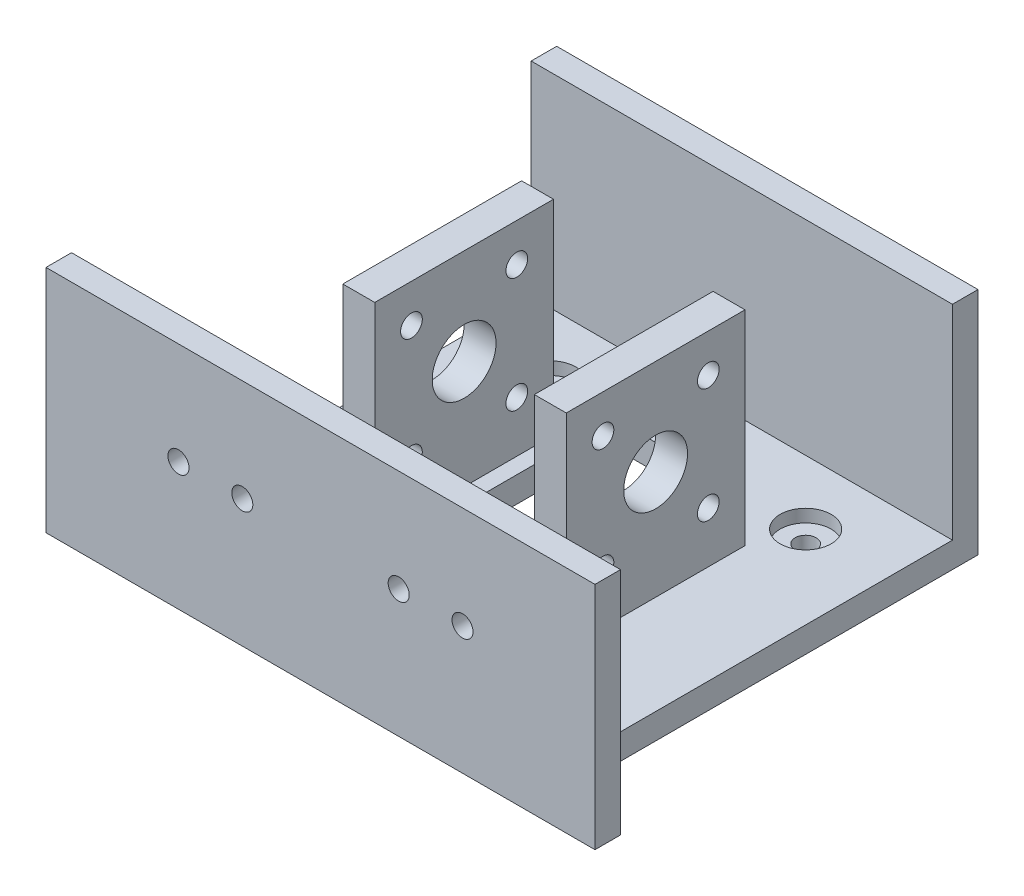
from build123d import *

# Parameters (mm, degrees)
SKETCH1_W                 = 75
SKETCH1_H                 = 40
SKETCH1_R                 = 5
SKETCH1_R_2               = 1.7
SKETCH1_W_2               = 10
SKETCH1_H_2               = 20
BOSS_EXTRUDE1_DEPTH       = 3
CUT_EXTRUDE1_DEPTH        = 43.605750786
CUT_EXTRUDE1_DEPTH_BACK   = 43.605750786
SKETCH2_W                 = 67
SKETCH2_H                 = 28
BOSS_EXTRUDE3_DEPTH       = 110
BOSS_EXTRUDE3_DEPTH_BACK  = 3
SKETCH6_W                 = 67
SKETCH6_H                 = 11
CUT_EXTRUDE4_DEPTH        = 122.372360939
SKETCH7_W                 = 70
SKETCH7_H                 = 37
BOSS_EXTRUDE4_DEPTH       = 45
SKETCH8_W                 = 45
SKETCH8_H                 = 62
CUT_EXTRUDE6_DEPTH        = 29
SKETCH11_W                = 45
SKETCH11_H                = 4
CUT_EXTRUDE9_DEPTH        = 157.445677473
SKETCH9_W                 = 38
SKETCH9_H                 = 28.5
CUT_EXTRUDE10_DEPTH       = 204.024629048
SKETCH13_W                = 5
SKETCH13_H                = 38
BOSS_EXTRUDE5_DEPTH       = 32
SKETCH14_R                = 5
SKETCH14_R_2              = 1.7
CUT_EXTRUDE11_DEPTH       = 32
SKETCH15_W                = 165
SKETCH15_H                = 70
SKETCH15_W_2              = 157
SKETCH15_H_2              = 62
BOSS_EXTRUDE6_DEPTH       = 3
SKETCH16_W                = 20
SKETCH16_H                = 4.820648258
CUT_EXTRUDE12_DEPTH       = 159.626132778
SKETCH18_R                = 1.65
CUT_EXTRUDE14_DEPTH       = 159.626132778
MIRROR6_COPY_1_SKETCH_W   = 5
MIRROR6_COPY_1_SKETCH_H   = 38
MIRROR6_COPY_1_DEPTH      = 32
MIRROR6_COPY_2_SKETCH_R   = 5
MIRROR6_COPY_2_SKETCH_R_2 = 1.7
MIRROR6_COPY_2_DEPTH      = 32
SKETCH19_W                = 38
SKETCH19_H                = 3.5
CUT_EXTRUDE15_DEPTH       = 10
SKETCH20_R                = 1.2
CUT_EXTRUDE16_DEPTH       = 10
SKETCH21_W                = 10
SKETCH21_H                = 80
CUT_EXTRUDE17_DEPTH       = 184.330984833
SKETCH22_W                = 55
SKETCH22_H                = 80
CUT_EXTRUDE18_DEPTH       = 184.330984833
SKETCH23_W                = 67
SKETCH23_H                = 62
BOSS_EXTRUDE7_DEPTH       = 4
SKETCH24_R                = 10
SKETCH24_R_2              = 1.65
CUT_EXTRUDE19_DEPTH       = 111.123793978
CUT_EXTRUDE21_START       = -16
SKETCH25_R                = 1.65
CUT_EXTRUDE21_DEPTH       = 16
SKETCH26_W                = 14.5
SKETCH26_H                = 36
CUT_EXTRUDE22_DEPTH       = 178.837706913
SKETCH27_W                = 5
SKETCH27_H                = 64
CUT_EXTRUDE23_DEPTH       = 43
CUT_EXTRUDE24_DEPTH       = 100.724620832
SKETCH29_R                = 4
SKETCH29_R_2              = 1.65
CUT_EXTRUDE25_DEPTH       = 2
SKETCH30_W                = 5
SKETCH30_H                = 28
BOSS_EXTRUDE8_DEPTH       = 32
CUT_EXTRUDE26_START       = -32
SKETCH32_R                = 5
SKETCH32_R_2              = 1.7
CUT_EXTRUDE26_DEPTH       = 32
CUT_EXTRUDE27_DEPTH       = 32
SKETCH36_R                = 1.65
CUT_EXTRUDE28_DEPTH       = 10
SKETCH37_W                = 6.586786374
SKETCH37_H                = 6.17536381
BOSS_EXTRUDE9_DEPTH       = 4
SKETCH38_W                = 25
SKETCH38_H                = 36
CUT_EXTRUDE29_DEPTH       = 10


with BuildPart() as part:
    # Sketch1 → Boss-Extrude1 (new body)
    with BuildSketch(Plane(origin=(0, 0, 0), x_dir=(1, 0, 0), z_dir=(0, 1, 0))):
        Rectangle(SKETCH1_W, SKETCH1_H)
        with Locations(Location((-21, 0, 0), (0, 0, 270))):
            Circle(SKETCH1_R, mode=Mode.SUBTRACT)
        with Locations(Location((-30, 8.25, 0), (0, 0, 270))):
            Circle(SKETCH1_R_2, mode=Mode.SUBTRACT)
        with Locations(Location((-12, 8.25, 0), (0, 0, 270))):
            Circle(SKETCH1_R_2, mode=Mode.SUBTRACT)
        with Locations(Location((-12, -8.25, 0), (0, 0, 270))):
            Circle(SKETCH1_R_2, mode=Mode.SUBTRACT)
        with Locations(Location((-30, -8.25, 0), (0, 0, 270))):
            Circle(SKETCH1_R_2, mode=Mode.SUBTRACT)
        with Locations(Location((12, 8.25, 0), (0, 0, 90))):
            Circle(SKETCH1_R_2, mode=Mode.SUBTRACT)
        with Locations(Location((12, -8.25, 0), (0, 0, 90))):
            Circle(SKETCH1_R_2, mode=Mode.SUBTRACT)
        with Locations(Location((21, 0, 0), (0, 0, 90))):
            Circle(SKETCH1_R, mode=Mode.SUBTRACT)
        with Locations(Location((30, -8.25, 0), (0, 0, 90))):
            Circle(SKETCH1_R_2, mode=Mode.SUBTRACT)
        with Locations(Location((30, 8.25, 0), (0, 0, 90))):
            Circle(SKETCH1_R_2, mode=Mode.SUBTRACT)
        Rectangle(SKETCH1_W_2, SKETCH1_H_2, mode=Mode.SUBTRACT)
    extrude(amount=BOSS_EXTRUDE1_DEPTH)

    # Sketch2 → Cut-Extrude1 (cut, two sides: drawn at the far end of the back side and taken through both)
    with BuildSketch(Plane(origin=(0, 3, 0), x_dir=(1, 0, 0), z_dir=(0, 1, 0)).offset(-CUT_EXTRUDE1_DEPTH_BACK)):
        Rectangle(SKETCH2_W, SKETCH2_H)
    extrude(amount=CUT_EXTRUDE1_DEPTH + CUT_EXTRUDE1_DEPTH_BACK, mode=Mode.SUBTRACT)

    # Sketch3 → Boss-Extrude3 (add, two sides: drawn at the far end of the back side and taken through both)
    with BuildSketch(Plane(origin=(0, 3, 0), x_dir=(1, 0, 0), z_dir=(0, 1, 0)).offset(-BOSS_EXTRUDE3_DEPTH_BACK)):
        Polygon((37.5, -35), (37.5, -20), (33.5, -20), (-33.5, -20), (-37.5, -20), (-37.5, -35), align=None)
        Polygon((33.5, 20), (37.5, 20), (37.5, 35), (-37.5, 35), (-37.5, 20), (-33.5, 20), align=None)
        Polygon((37.5, -20), (37.5, 20), (33.5, 20), (33.5, 14), (33.5, -14), (33.5, -20), align=None)
        Polygon((-33.5, 14), (-33.5, 20), (-37.5, 20), (-37.5, -20), (-33.5, -20), (-33.5, -14), align=None)
    extrude(amount=BOSS_EXTRUDE3_DEPTH + BOSS_EXTRUDE3_DEPTH_BACK)

    # Sketch6 → Cut-Extrude4 (cut, through all)
    with BuildSketch(Plane(origin=(0, 3, 0), x_dir=(1, 0, 0), z_dir=(0, 1, 0))):
        with Locations((0, -25.5)):
            Rectangle(SKETCH6_W, SKETCH6_H)
        with Locations((0, 25.5)):
            Rectangle(SKETCH6_W, SKETCH6_H)
    extrude(amount=CUT_EXTRUDE4_DEPTH, mode=Mode.SUBTRACT)

    # Sketch7 → Boss-Extrude4 (add)
    with BuildSketch(Plane.ZY.offset(37.5)):
        with Locations((0, 94.5)):
            Rectangle(SKETCH7_W, SKETCH7_H)
    boss_extrude4 = extrude(amount=BOSS_EXTRUDE4_DEPTH)

    # Mirror2: Boss-Extrude4 across plane
    add(boss_extrude4.mirror(Plane(origin=(0, 0, 0), x_dir=(0, 0, 1), z_dir=(1, 0, 0))))

    # Sketch8 → Cut-Extrude6 (cut)
    with BuildSketch(Plane(origin=(0, 113, 0), x_dir=(1, 0, 0), z_dir=(0, 1, 0))):
        with Locations((-56, 0)):
            Rectangle(SKETCH8_W, SKETCH8_H)
        with Locations((56, 0)):
            Rectangle(SKETCH8_W, SKETCH8_H)
    extrude(amount=-CUT_EXTRUDE6_DEPTH, mode=Mode.SUBTRACT)

    # Sketch11 → Cut-Extrude9 (cut, through all)
    with BuildSketch(Plane.XY.offset(35)):
        with Locations((-60, 78)):
            Rectangle(SKETCH11_W, SKETCH11_H)
        with Locations((60, 78)):
            Rectangle(SKETCH11_W, SKETCH11_H)
    extrude(amount=-CUT_EXTRUDE9_DEPTH, mode=Mode.SUBTRACT)

    # Sketch9 → Cut-Extrude10 (cut, through all)
    with BuildSketch(Plane.ZY.offset(82.5)):
        with Locations((0, 98.25)):
            Rectangle(SKETCH9_W, SKETCH9_H)
    extrude(amount=-CUT_EXTRUDE10_DEPTH, mode=Mode.SUBTRACT)

    # Sketch13 → Boss-Extrude5 (add)
    with BuildSketch(Plane(origin=(0, 84, 0), x_dir=(1, 0, 0), z_dir=(0, 1, 0))):
        with Locations((-39, 0)):
            Rectangle(SKETCH13_W, SKETCH13_H)
    boss_extrude5 = extrude(amount=BOSS_EXTRUDE5_DEPTH)

    # Sketch14 → Cut-Extrude11 (cut)
    with BuildSketch(Plane.ZY.offset(41.5)):
        with Locations((0, 101)):
            Circle(SKETCH14_R)
        with Locations((-8.25, 110)):
            Circle(SKETCH14_R_2)
        with Locations((8.25, 110)):
            Circle(SKETCH14_R_2)
        with Locations((8.25, 92)):
            Circle(SKETCH14_R_2)
        with Locations((-8.25, 92)):
            Circle(SKETCH14_R_2)
    cut_extrude11 = extrude(amount=-CUT_EXTRUDE11_DEPTH, mode=Mode.SUBTRACT)

    # Mirror4: Boss-Extrude5, Cut-Extrude11 across plane
    add(boss_extrude5.mirror(Plane(origin=(0, 0, 0), x_dir=(0, 0, 1), z_dir=(1, 0, 0))))
    add(cut_extrude11.mirror(Plane(origin=(0, 0, 0), x_dir=(0, 0, 1), z_dir=(1, 0, 0))), mode=Mode.SUBTRACT)

    # Sketch15 → Boss-Extrude6 (add)
    with BuildSketch(Plane(origin=(0, 113, 0), x_dir=(1, 0, 0), z_dir=(0, 1, 0))):
        Rectangle(SKETCH15_W, SKETCH15_H)
        Rectangle(SKETCH15_W_2, SKETCH15_H_2, mode=Mode.SUBTRACT)
    extrude(amount=BOSS_EXTRUDE6_DEPTH)

    # Sketch16 → Cut-Extrude12 (cut, through all)
    with BuildSketch(Plane.XY.offset(35)):
        with Locations((0, 11.636111214)):
            Rectangle(SKETCH16_W, SKETCH16_H)
    extrude(amount=-CUT_EXTRUDE12_DEPTH, mode=Mode.SUBTRACT)

    # Sketch18 → Cut-Extrude14 (cut, through all)
    with BuildSketch(Plane.XY.offset(35)):
        with Locations((52.25, 100)):
            Circle(SKETCH18_R)
    cut_extrude14 = extrude(amount=-CUT_EXTRUDE14_DEPTH, mode=Mode.SUBTRACT)

    # Mirror5: Cut-Extrude14 across plane
    add(cut_extrude14.mirror(Plane(origin=(0, 0, 0), x_dir=(0, 0, 1), z_dir=(1, 0, 0))), mode=Mode.SUBTRACT)

    # Mirror6: Boss-Extrude5, Cut-Extrude11 across plane
    add(boss_extrude5.mirror(Plane.ZX.offset(116)))
    add(cut_extrude11.mirror(Plane.ZX.offset(116)), mode=Mode.SUBTRACT)

    # Mirror6 copy 1 sketch → Mirror6 copy 1 (add)
    with BuildSketch(Plane(origin=(0, 148, 0), x_dir=(-1, 0, 0), z_dir=(0, -1, 0))):
        with Locations((-39, 0)):
            Rectangle(MIRROR6_COPY_1_SKETCH_W, MIRROR6_COPY_1_SKETCH_H)
    extrude(amount=MIRROR6_COPY_1_DEPTH)

    # Mirror6 copy 2 sketch → Mirror6 copy 2 (cut)
    with BuildSketch(Plane(origin=(41.5, 232, 0), x_dir=(0, 0, 1), z_dir=(1, 0, 0))):
        with Locations((0, 101)):
            Circle(MIRROR6_COPY_2_SKETCH_R)
        with Locations((-8.25, 110)):
            Circle(MIRROR6_COPY_2_SKETCH_R_2)
        with Locations((8.25, 110)):
            Circle(MIRROR6_COPY_2_SKETCH_R_2)
        with Locations((8.25, 92)):
            Circle(MIRROR6_COPY_2_SKETCH_R_2)
        with Locations((-8.25, 92)):
            Circle(MIRROR6_COPY_2_SKETCH_R_2)
    extrude(amount=-MIRROR6_COPY_2_DEPTH, mode=Mode.SUBTRACT)

    # Sketch19 → Cut-Extrude15 (cut)
    with BuildSketch(Plane(origin=(82.5, 0, 0), x_dir=(0, 0, -1), z_dir=(1, 0, 0))):
        with Locations((0, 114.25)):
            Rectangle(SKETCH19_W, SKETCH19_H)
    cut_extrude15 = extrude(amount=-CUT_EXTRUDE15_DEPTH, mode=Mode.SUBTRACT)

    # Mirror7: Cut-Extrude15 across plane
    add(cut_extrude15.mirror(Plane(origin=(0, 0, 0), x_dir=(0, 0, 1), z_dir=(1, 0, 0))), mode=Mode.SUBTRACT)

    # Sketch20 → Cut-Extrude16 (cut)
    with BuildSketch(Plane(origin=(0, 3, 0), x_dir=(1, 0, 0), z_dir=(0, 1, 0))):
        with Locations(Location((-24, 17.5, 0), (0, 0, 270))):
            Circle(SKETCH20_R)
        with Locations(Location((-12, 17.5, 0), (0, 0, 270))):
            Circle(SKETCH20_R)
        with Locations(Location((12, 17.5, 0), (0, 0, 270))):
            Circle(SKETCH20_R)
        with Locations(Location((-24, -17.5, 0), (0, 0, 270))):
            Circle(SKETCH20_R)
        with Locations(Location((-12, -17.5, 0), (0, 0, 270))):
            Circle(SKETCH20_R)
        with Locations(Location((24, 17.5, 0), (0, 0, 270))):
            Circle(SKETCH20_R)
        with Locations(Location((12, -17.5, 0), (0, 0, 270))):
            Circle(SKETCH20_R)
        with Locations(Location((24, -17.5, 0), (0, 0, 270))):
            Circle(SKETCH20_R)
    extrude(amount=-CUT_EXTRUDE16_DEPTH, mode=Mode.SUBTRACT)

    # Sketch21 → Cut-Extrude17 (cut, through all)
    with BuildSketch(Plane.XY.offset(35)):
        with Locations((32.5, 40)):
            Rectangle(SKETCH21_W, SKETCH21_H)
        with Locations((-32.5, 40)):
            Rectangle(SKETCH21_W, SKETCH21_H)
    extrude(amount=-CUT_EXTRUDE17_DEPTH, mode=Mode.SUBTRACT)

    # Sketch22 → Cut-Extrude18 (cut, through all)
    with BuildSketch(Plane.XY.offset(35)):
        with Locations((0, 40)):
            Rectangle(SKETCH22_W, SKETCH22_H)
    extrude(amount=-CUT_EXTRUDE18_DEPTH, mode=Mode.SUBTRACT)

    # Sketch23 → Boss-Extrude7 (add)
    with BuildSketch(Plane.XZ.offset(-80)):
        Rectangle(SKETCH23_W, SKETCH23_H)
    extrude(amount=-BOSS_EXTRUDE7_DEPTH)

    # Sketch24 → Cut-Extrude19 (cut, through all)
    with BuildSketch(Plane(origin=(0, 84, 0), x_dir=(1, 0, 0), z_dir=(0, 1, 0))):
        with Locations(Location((0, 0, 0), (0, 0, 270))):
            Circle(SKETCH24_R)
        with Locations(Location((-20, 21, 0), (0, 0, 270))):
            Circle(SKETCH24_R_2)
        with Locations(Location((-20, -21, 0), (0, 0, 270))):
            Circle(SKETCH24_R_2)
        with Locations(Location((20, -21, 0), (0, 0, 90))):
            Circle(SKETCH24_R_2)
        with Locations(Location((20, 21, 0), (0, 0, 90))):
            Circle(SKETCH24_R_2)
    extrude(amount=-CUT_EXTRUDE19_DEPTH, mode=Mode.SUBTRACT)

    # Sketch25 → Cut-Extrude21 (cut)
    with BuildSketch(Plane(origin=(0, 0, -35), x_dir=(-1, 0, 0), z_dir=(0, 0, -1)).offset(CUT_EXTRUDE21_START)):
        Polygon((33.5, 116), (33.5, 84), (33.5, 80), (82.5, 80), (82.5, 116), align=None)
        with Locations((52.25, 100)):
            Circle(SKETCH25_R, mode=Mode.SUBTRACT)
    cut_extrude21 = extrude(amount=CUT_EXTRUDE21_DEPTH, mode=Mode.SUBTRACT)

    # Mirror8: Cut-Extrude21 across plane
    add(cut_extrude21.mirror(Plane(origin=(0, 0, 0), x_dir=(0, 0, 1), z_dir=(1, 0, 0))), mode=Mode.SUBTRACT)

    # Sketch26 → Cut-Extrude22 (cut, through all)
    with BuildSketch(Plane(origin=(0, 0, -19), x_dir=(-1, 0, 0), z_dir=(0, 0, -1))):
        with Locations((75.25, 98)):
            Rectangle(SKETCH26_W, SKETCH26_H)
    cut_extrude22 = extrude(amount=-CUT_EXTRUDE22_DEPTH, mode=Mode.SUBTRACT)

    # Mirror9: Cut-Extrude22 across plane
    add(cut_extrude22.mirror(Plane(origin=(0, 0, 0), x_dir=(0, 0, 1), z_dir=(1, 0, 0))), mode=Mode.SUBTRACT)

    # Sketch27 → Cut-Extrude23 (cut)
    with BuildSketch(Plane(origin=(0, 0, -19), x_dir=(-1, 0, 0), z_dir=(0, 0, -1))):
        with Locations((-39, 116)):
            Rectangle(SKETCH27_W, SKETCH27_H)
    extrude(amount=-CUT_EXTRUDE23_DEPTH, mode=Mode.SUBTRACT)

    # Sketch28 → Cut-Extrude24 (cut, symmetric)
    with BuildSketch(Plane(origin=(0, 84, 0), x_dir=(1, 0, 0), z_dir=(0, 1, 0))):
        Polygon((68, 19), (33.5, 19), (33.5, 35), (33, 35), (33, 19), (33, -31), (68, -31), align=None)
    cut_extrude24 = extrude(amount=CUT_EXTRUDE24_DEPTH, both=True, mode=Mode.SUBTRACT)

    # Sketch29 → Cut-Extrude25 (cut)
    # profile 1 of 4: a face of its own
    with BuildSketch(Plane(origin=(0, 84, 0), x_dir=(1, 0, 0), z_dir=(0, 1, 0))):
        with Locations(Location((20, 21, 0), (0, 0, 270))):
            Circle(SKETCH29_R)
        with Locations(Location((20, 21, 0), (0, 0, 270))):
            Circle(SKETCH29_R_2, mode=Mode.SUBTRACT)
    # profile 2 of 4: a face of its own
    with BuildSketch(Plane(origin=(0, 84, 0), x_dir=(1, 0, 0), z_dir=(0, 1, 0))):
        with Locations(Location((-20, 21, 0), (0, 0, 270))):
            Circle(SKETCH29_R)
        with Locations(Location((-20, 21, 0), (0, 0, 270))):
            Circle(SKETCH29_R_2, mode=Mode.SUBTRACT)
    # profile 3 of 4: a face of its own
    with BuildSketch(Plane(origin=(0, 84, 0), x_dir=(1, 0, 0), z_dir=(0, 1, 0))):
        with Locations(Location((-20, -21, 0), (0, 0, 270))):
            Circle(SKETCH29_R)
        with Locations(Location((-20, -21, 0), (0, 0, 270))):
            Circle(SKETCH29_R_2, mode=Mode.SUBTRACT)
    # profile 4 of 4: a face of its own
    with BuildSketch(Plane(origin=(0, 84, 0), x_dir=(1, 0, 0), z_dir=(0, 1, 0))):
        with Locations(Location((20, -21, 0), (0, 0, 270))):
            Circle(SKETCH29_R)
        with Locations(Location((20, -21, 0), (0, 0, 270))):
            Circle(SKETCH29_R_2, mode=Mode.SUBTRACT)
    extrude(amount=-CUT_EXTRUDE25_DEPTH, mode=Mode.SUBTRACT)

    # Sketch30 → Boss-Extrude8 (add)
    with BuildSketch(Plane(origin=(0, 84, 0), x_dir=(1, 0, 0), z_dir=(0, 1, 0))):
        with Locations((15, 0)):
            Rectangle(SKETCH30_W, SKETCH30_H)
    boss_extrude8 = extrude(amount=BOSS_EXTRUDE8_DEPTH)

    # Sketch32 → Cut-Extrude26 (cut)
    with BuildSketch(Plane(origin=(17.5, 0, 0), x_dir=(0, 0, -1), z_dir=(1, 0, 0)).offset(CUT_EXTRUDE26_START)):
        with Locations(Location((0, 101, 0), (0, 0, 180))):
            Circle(SKETCH32_R)
        with Locations(Location((8.25, 110, 0), (0, 0, 180))):
            Circle(SKETCH32_R_2)
        with Locations(Location((-8.25, 110, 0), (0, 0, 180))):
            Circle(SKETCH32_R_2)
        with Locations(Location((-8.25, 92, 0), (0, 0, 180))):
            Circle(SKETCH32_R_2)
        with Locations(Location((8.25, 92, 0), (0, 0, 180))):
            Circle(SKETCH32_R_2)
    cut_extrude26 = extrude(amount=CUT_EXTRUDE26_DEPTH, mode=Mode.SUBTRACT)

    # Mirror11: Cut-Extrude24 across plane
    add(cut_extrude24.mirror(Plane(origin=(0, 0, 0), x_dir=(0, 0, 1), z_dir=(1, 0, 0))), mode=Mode.SUBTRACT)

    # Mirror16: Boss-Extrude8 across plane
    add(boss_extrude8.mirror(Plane(origin=(0, 0, 0), x_dir=(0, 0, 1), z_dir=(1, 0, 0))))

    # Mirror18: Cut-Extrude26 across plane
    add(cut_extrude26.mirror(Plane(origin=(0, 0, 0), x_dir=(0, 0, 1), z_dir=(1, 0, 0))), mode=Mode.SUBTRACT)

    # Sketch34 → Cut-Extrude27 (cut)
    with BuildSketch(Plane(origin=(0, 84, 0), x_dir=(1, 0, 0), z_dir=(0, 1, 0))):
        with BuildLine():
            Line((-10, 21), (-10, 0))
            ThreePointArc((-10, 0), (0, 10), (10, 0))
            Line((10, 0), (10, 21))
            Line((10, 21), (-10, 21))
        make_face()
        with BuildLine():
            ThreePointArc((10, 0), (0, -10), (-10, 0))
            Line((-10, 0), (-10, -21))
            Line((-10, -21), (10, -21))
            Line((10, -21), (10, 0))
        make_face()
    extrude(amount=-CUT_EXTRUDE27_DEPTH, mode=Mode.SUBTRACT)

    # Sketch36 → Cut-Extrude28 (cut)
    with BuildSketch(Plane.XY.offset(35)):
        with Locations((22.25, 100)):
            Circle(SKETCH36_R)
        with Locations((12.25, 100)):
            Circle(SKETCH36_R)
        with Locations(Location((-12.25, 100, 0), (0, 0, 180))):
            Circle(SKETCH36_R)
        with Locations(Location((-22.25, 100, 0), (0, 0, 180))):
            Circle(SKETCH36_R)
    extrude(amount=-CUT_EXTRUDE28_DEPTH, mode=Mode.SUBTRACT)

    # Sketch37 → Boss-Extrude9 (add)
    with BuildSketch(Plane.XY.offset(35)):
        with Locations((52.25, 100)):
            Rectangle(SKETCH37_W, SKETCH37_H)
        with Locations((-52.25, 100)):
            Rectangle(SKETCH37_W, SKETCH37_H)
    extrude(amount=-BOSS_EXTRUDE9_DEPTH)

    # Sketch38 → Cut-Extrude29 (cut)
    with BuildSketch(Plane.XY.offset(35)):
        with Locations((-55.5, 98)):
            Rectangle(SKETCH38_W, SKETCH38_H)
        with Locations((55.5, 98)):
            Rectangle(SKETCH38_W, SKETCH38_H)
    extrude(amount=-CUT_EXTRUDE29_DEPTH, mode=Mode.SUBTRACT)


solid = part.part
